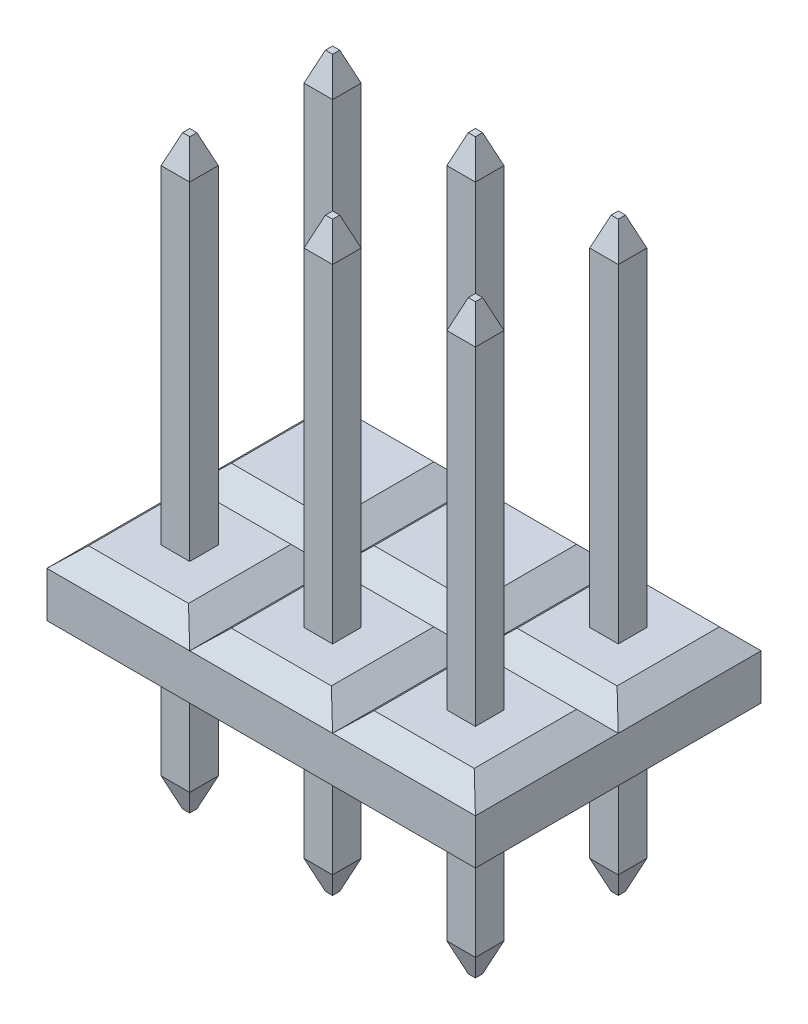
from build123d import *
from OCP.BRepFilletAPI import BRepFilletAPI_MakeChamfer

# Parameters (mm, degrees)
SKETCH1_W                   = 2.54
SKETCH1_H                   = 2.54
BOSS_EXTRUDE1_DEPTH         = 1.524
SKETCH2_W                   = 0.508
SKETCH2_H                   = 0.508
BOSS_EXTRUDE2_DEPTH         = 6.35
SKETCH3_W                   = 0.508
SKETCH3_H                   = 0.508
BOSS_EXTRUDE3_DEPTH         = 2.54
CHAMFER1_SIZE               = 0.508
CHAMFER1_SIZE2              = 0.1905
CHAMFER2_SIZE               = 0.508
CHAMFER2_SIZE2              = 0.1905
CUT_EXTRUDE1_DEPTH          = 2.54
CUT_EXTRUDE2_DEPTH          = 2.54
LPATTERN5_COUNT             = 2
LPATTERN5_PITCH             = 2.54
LPATTERN5_COUNT_DIR2        = 3
LPATTERN5_PITCH_DIR2        = 2.54
CHAMFER1_OF_LPATTERN5_SIZE  = 0.508
CHAMFER1_OF_LPATTERN5_SIZE2 = 0.1905
CHAMFER2_OF_LPATTERN5_SIZE  = 0.508
CHAMFER2_OF_LPATTERN5_SIZE2 = 0.1905


with BuildPart() as part:
    # Sketch1 → Boss-Extrude1 (new body)
    with BuildSketch(Plane(origin=(0, 0, 0), x_dir=(1, 0, 0), z_dir=(0, 1, 0))):
        with Locations((1.27, 1.27)):
            Rectangle(SKETCH1_W, SKETCH1_H)
    boss_extrude1 = extrude(amount=BOSS_EXTRUDE1_DEPTH)

    # Sketch2 → Boss-Extrude2 (add)
    with BuildSketch(Plane(origin=(0, 1.524, 0), x_dir=(1, 0, 0), z_dir=(0, 1, 0))):
        with Locations((1.27, 1.27)):
            Rectangle(SKETCH2_W, SKETCH2_H)
    boss_extrude2 = extrude(amount=BOSS_EXTRUDE2_DEPTH)

    # Sketch3 → Boss-Extrude3 (add)
    with BuildSketch(Plane.XZ):
        with Locations((1.27, -1.27)):
            Rectangle(SKETCH3_W, SKETCH3_H)
    boss_extrude3 = extrude(amount=BOSS_EXTRUDE3_DEPTH)

    # Chamfer1: one chamfer whose edges measure the first distance from different faces: ONE call of the kernel's chamfer builder (chamfer() names one face for all edges)
    chamfer1_edges_1 = [part.edges().sort_by_distance(p)[0] for p in [
        (1.016, 7.874, -1.27),
    ]]
    chamfer1_side_1 = [part.faces().sort_by_distance(p)[0] for p in [
        (1.016, 4.699, -1.27),
    ]]
    chamfer1_edges_2 = [part.edges().sort_by_distance(p)[0] for p in [
        (1.27, 7.874, -1.016),
    ]]
    chamfer1_side_2 = [part.faces().sort_by_distance(p)[0] for p in [
        (1.27, 4.699, -1.016),
    ]]
    chamfer1_edges_3 = [part.edges().sort_by_distance(p)[0] for p in [
        (1.524, 7.874, -1.27),
    ]]
    chamfer1_side_3 = [part.faces().sort_by_distance(p)[0] for p in [
        (1.524, 4.699, -1.27),
    ]]
    chamfer1_edges_4 = [part.edges().sort_by_distance(p)[0] for p in [
        (1.27, 7.874, -1.524),
    ]]
    chamfer1_side_4 = [part.faces().sort_by_distance(p)[0] for p in [
        (1.27, 4.699, -1.524),
    ]]
    chamfer1 = BRepFilletAPI_MakeChamfer(part.part.solid().wrapped)
    for e in chamfer1_edges_1:
        chamfer1.Add(CHAMFER1_SIZE, CHAMFER1_SIZE2, e.wrapped, chamfer1_side_1[0].wrapped)  # the first distance lies on this face
    for e in chamfer1_edges_2:
        chamfer1.Add(CHAMFER1_SIZE, CHAMFER1_SIZE2, e.wrapped, chamfer1_side_2[0].wrapped)  # the first distance lies on this face
    for e in chamfer1_edges_3:
        chamfer1.Add(CHAMFER1_SIZE, CHAMFER1_SIZE2, e.wrapped, chamfer1_side_3[0].wrapped)  # the first distance lies on this face
    for e in chamfer1_edges_4:
        chamfer1.Add(CHAMFER1_SIZE, CHAMFER1_SIZE2, e.wrapped, chamfer1_side_4[0].wrapped)  # the first distance lies on this face
    add(Compound.cast(chamfer1.Shape()), mode=Mode.REPLACE)

    # Chamfer2: one chamfer whose edges measure the first distance from different faces: ONE call of the kernel's chamfer builder (chamfer() names one face for all edges)
    chamfer2_edges_1 = [part.edges().sort_by_distance(p)[0] for p in [
        (1.27, -2.54, -1.524),
    ]]
    chamfer2_side_1 = [part.faces().sort_by_distance(p)[0] for p in [
        (1.27, -1.27, -1.524),
    ]]
    chamfer2_edges_2 = [part.edges().sort_by_distance(p)[0] for p in [
        (1.524, -2.54, -1.27),
    ]]
    chamfer2_side_2 = [part.faces().sort_by_distance(p)[0] for p in [
        (1.524, -1.27, -1.27),
    ]]
    chamfer2_edges_3 = [part.edges().sort_by_distance(p)[0] for p in [
        (1.27, -2.54, -1.016),
    ]]
    chamfer2_side_3 = [part.faces().sort_by_distance(p)[0] for p in [
        (1.27, -1.27, -1.016),
    ]]
    chamfer2_edges_4 = [part.edges().sort_by_distance(p)[0] for p in [
        (1.016, -2.54, -1.27),
    ]]
    chamfer2_side_4 = [part.faces().sort_by_distance(p)[0] for p in [
        (1.016, -1.27, -1.27),
    ]]
    chamfer2 = BRepFilletAPI_MakeChamfer(part.part.solid().wrapped)
    for e in chamfer2_edges_1:
        chamfer2.Add(CHAMFER2_SIZE, CHAMFER2_SIZE2, e.wrapped, chamfer2_side_1[0].wrapped)  # the first distance lies on this face
    for e in chamfer2_edges_2:
        chamfer2.Add(CHAMFER2_SIZE, CHAMFER2_SIZE2, e.wrapped, chamfer2_side_2[0].wrapped)  # the first distance lies on this face
    for e in chamfer2_edges_3:
        chamfer2.Add(CHAMFER2_SIZE, CHAMFER2_SIZE2, e.wrapped, chamfer2_side_3[0].wrapped)  # the first distance lies on this face
    for e in chamfer2_edges_4:
        chamfer2.Add(CHAMFER2_SIZE, CHAMFER2_SIZE2, e.wrapped, chamfer2_side_4[0].wrapped)  # the first distance lies on this face
    add(Compound.cast(chamfer2.Shape()), mode=Mode.REPLACE)

    # Sketch4 → Cut-Extrude1 (cut)
    with BuildSketch(Plane(origin=(0, 0, -2.54), x_dir=(-1, 0, 0), z_dir=(0, 0, -1))):
        Polygon((-2.54, 1.16453539), (-2.159, 1.524), (-2.54, 1.524), align=None)
        Polygon((0, 1.524), (0, 1.16453539), (-0.381, 1.524), align=None)
        Polygon((0, 0.35946461), (-0.381, 0), (0, 0), align=None)
        Polygon((-2.54, 0), (-2.54, 0.35946461), (-2.159, 0), align=None)
    cut_extrude1 = extrude(amount=-CUT_EXTRUDE1_DEPTH, mode=Mode.SUBTRACT)

    # Sketch5 → Cut-Extrude2 (cut)
    with BuildSketch(Plane.ZY):
        Polygon((-2.54, 1.16453539), (-2.159, 1.54553539), (-2.54, 1.54553539), align=None)
        Polygon((0, 1.54553539), (0, 1.16453539), (-0.381, 1.54553539), align=None)
        Polygon((-2.54, -0.02153539), (-2.54, 0.35946461), (-2.159, -0.02153539), align=None)
        Polygon((0, 0.35946461), (-0.381, -0.02153539), (0, -0.02153539), align=None)
    cut_extrude2 = extrude(amount=-CUT_EXTRUDE2_DEPTH, mode=Mode.SUBTRACT)

    # LPattern5: Boss-Extrude1, Boss-Extrude2, Boss-Extrude3, Cut-Extrude1, Cut-Extrude2 2 × 3
    with Locations(*[(j * LPATTERN5_PITCH_DIR2, 0, i * LPATTERN5_PITCH) for i in range(LPATTERN5_COUNT) for j in range(LPATTERN5_COUNT_DIR2) if (i, j) != (0, 0)]):
        add(boss_extrude1)
        add(boss_extrude2)
        add(boss_extrude3)
        add(cut_extrude1, mode=Mode.SUBTRACT)
        add(cut_extrude2, mode=Mode.SUBTRACT)

    # Chamfer1 of LPattern5: one chamfer whose edges measure the first distance from different faces: ONE call of the kernel's chamfer builder (chamfer() names one face for all edges)
    chamfer1_of_lpattern5_edges_1 = [part.edges().sort_by_distance(p)[0] for p in [
        (3.556, 7.874, -1.27),
    ]]
    chamfer1_of_lpattern5_side_1 = [part.faces().sort_by_distance(p)[0] for p in [
        (3.556, 4.699, -1.27),
    ]]
    chamfer1_of_lpattern5_edges_2 = [part.edges().sort_by_distance(p)[0] for p in [
        (3.81, 7.874, -1.016),
    ]]
    chamfer1_of_lpattern5_side_2 = [part.faces().sort_by_distance(p)[0] for p in [
        (3.81, 4.699, -1.016),
    ]]
    chamfer1_of_lpattern5_edges_3 = [part.edges().sort_by_distance(p)[0] for p in [
        (4.064, 7.874, -1.27),
    ]]
    chamfer1_of_lpattern5_side_3 = [part.faces().sort_by_distance(p)[0] for p in [
        (4.064, 4.699, -1.27),
    ]]
    chamfer1_of_lpattern5_edges_4 = [part.edges().sort_by_distance(p)[0] for p in [
        (3.81, 7.874, -1.524),
    ]]
    chamfer1_of_lpattern5_side_4 = [part.faces().sort_by_distance(p)[0] for p in [
        (3.81, 4.699, -1.524),
    ]]
    chamfer1_of_lpattern5_edges_5 = [part.edges().sort_by_distance(p)[0] for p in [
        (6.096, 7.874, -1.27),
    ]]
    chamfer1_of_lpattern5_side_5 = [part.faces().sort_by_distance(p)[0] for p in [
        (6.096, 4.699, -1.27),
    ]]
    chamfer1_of_lpattern5_edges_6 = [part.edges().sort_by_distance(p)[0] for p in [
        (6.35, 7.874, -1.016),
    ]]
    chamfer1_of_lpattern5_side_6 = [part.faces().sort_by_distance(p)[0] for p in [
        (6.35, 4.699, -1.016),
    ]]
    chamfer1_of_lpattern5_edges_7 = [part.edges().sort_by_distance(p)[0] for p in [
        (6.604, 7.874, -1.27),
    ]]
    chamfer1_of_lpattern5_side_7 = [part.faces().sort_by_distance(p)[0] for p in [
        (6.604, 4.699, -1.27),
    ]]
    chamfer1_of_lpattern5_edges_8 = [part.edges().sort_by_distance(p)[0] for p in [
        (6.35, 7.874, -1.524),
    ]]
    chamfer1_of_lpattern5_side_8 = [part.faces().sort_by_distance(p)[0] for p in [
        (6.35, 4.699, -1.524),
    ]]
    chamfer1_of_lpattern5_edges_9 = [part.edges().sort_by_distance(p)[0] for p in [
        (1.016, 7.874, 1.27),
    ]]
    chamfer1_of_lpattern5_side_9 = [part.faces().sort_by_distance(p)[0] for p in [
        (1.016, 4.699, 1.27),
    ]]
    chamfer1_of_lpattern5_edges_10 = [part.edges().sort_by_distance(p)[0] for p in [
        (1.27, 7.874, 1.524),
    ]]
    chamfer1_of_lpattern5_side_10 = [part.faces().sort_by_distance(p)[0] for p in [
        (1.27, 4.699, 1.524),
    ]]
    chamfer1_of_lpattern5_edges_11 = [part.edges().sort_by_distance(p)[0] for p in [
        (1.524, 7.874, 1.27),
    ]]
    chamfer1_of_lpattern5_side_11 = [part.faces().sort_by_distance(p)[0] for p in [
        (1.524, 4.699, 1.27),
    ]]
    chamfer1_of_lpattern5_edges_12 = [part.edges().sort_by_distance(p)[0] for p in [
        (1.27, 7.874, 1.016),
    ]]
    chamfer1_of_lpattern5_side_12 = [part.faces().sort_by_distance(p)[0] for p in [
        (1.27, 4.699, 1.016),
    ]]
    chamfer1_of_lpattern5_edges_13 = [part.edges().sort_by_distance(p)[0] for p in [
        (3.556, 7.874, 1.27),
    ]]
    chamfer1_of_lpattern5_side_13 = [part.faces().sort_by_distance(p)[0] for p in [
        (3.556, 4.699, 1.27),
    ]]
    chamfer1_of_lpattern5_edges_14 = [part.edges().sort_by_distance(p)[0] for p in [
        (3.81, 7.874, 1.524),
    ]]
    chamfer1_of_lpattern5_side_14 = [part.faces().sort_by_distance(p)[0] for p in [
        (3.81, 4.699, 1.524),
    ]]
    chamfer1_of_lpattern5_edges_15 = [part.edges().sort_by_distance(p)[0] for p in [
        (4.064, 7.874, 1.27),
    ]]
    chamfer1_of_lpattern5_side_15 = [part.faces().sort_by_distance(p)[0] for p in [
        (4.064, 4.699, 1.27),
    ]]
    chamfer1_of_lpattern5_edges_16 = [part.edges().sort_by_distance(p)[0] for p in [
        (3.81, 7.874, 1.016),
    ]]
    chamfer1_of_lpattern5_side_16 = [part.faces().sort_by_distance(p)[0] for p in [
        (3.81, 4.699, 1.016),
    ]]
    chamfer1_of_lpattern5_edges_17 = [part.edges().sort_by_distance(p)[0] for p in [
        (6.096, 7.874, 1.27),
    ]]
    chamfer1_of_lpattern5_side_17 = [part.faces().sort_by_distance(p)[0] for p in [
        (6.096, 4.699, 1.27),
    ]]
    chamfer1_of_lpattern5_edges_18 = [part.edges().sort_by_distance(p)[0] for p in [
        (6.35, 7.874, 1.524),
    ]]
    chamfer1_of_lpattern5_side_18 = [part.faces().sort_by_distance(p)[0] for p in [
        (6.35, 4.699, 1.524),
    ]]
    chamfer1_of_lpattern5_edges_19 = [part.edges().sort_by_distance(p)[0] for p in [
        (6.604, 7.874, 1.27),
    ]]
    chamfer1_of_lpattern5_side_19 = [part.faces().sort_by_distance(p)[0] for p in [
        (6.604, 4.699, 1.27),
    ]]
    chamfer1_of_lpattern5_edges_20 = [part.edges().sort_by_distance(p)[0] for p in [
        (6.35, 7.874, 1.016),
    ]]
    chamfer1_of_lpattern5_side_20 = [part.faces().sort_by_distance(p)[0] for p in [
        (6.35, 4.699, 1.016),
    ]]
    chamfer1_of_lpattern5 = BRepFilletAPI_MakeChamfer(part.part.solid().wrapped)
    for e in chamfer1_of_lpattern5_edges_1:
        chamfer1_of_lpattern5.Add(CHAMFER1_OF_LPATTERN5_SIZE, CHAMFER1_OF_LPATTERN5_SIZE2, e.wrapped, chamfer1_of_lpattern5_side_1[0].wrapped)  # the first distance lies on this face
    for e in chamfer1_of_lpattern5_edges_2:
        chamfer1_of_lpattern5.Add(CHAMFER1_OF_LPATTERN5_SIZE, CHAMFER1_OF_LPATTERN5_SIZE2, e.wrapped, chamfer1_of_lpattern5_side_2[0].wrapped)  # the first distance lies on this face
    for e in chamfer1_of_lpattern5_edges_3:
        chamfer1_of_lpattern5.Add(CHAMFER1_OF_LPATTERN5_SIZE, CHAMFER1_OF_LPATTERN5_SIZE2, e.wrapped, chamfer1_of_lpattern5_side_3[0].wrapped)  # the first distance lies on this face
    for e in chamfer1_of_lpattern5_edges_4:
        chamfer1_of_lpattern5.Add(CHAMFER1_OF_LPATTERN5_SIZE, CHAMFER1_OF_LPATTERN5_SIZE2, e.wrapped, chamfer1_of_lpattern5_side_4[0].wrapped)  # the first distance lies on this face
    for e in chamfer1_of_lpattern5_edges_5:
        chamfer1_of_lpattern5.Add(CHAMFER1_OF_LPATTERN5_SIZE, CHAMFER1_OF_LPATTERN5_SIZE2, e.wrapped, chamfer1_of_lpattern5_side_5[0].wrapped)  # the first distance lies on this face
    for e in chamfer1_of_lpattern5_edges_6:
        chamfer1_of_lpattern5.Add(CHAMFER1_OF_LPATTERN5_SIZE, CHAMFER1_OF_LPATTERN5_SIZE2, e.wrapped, chamfer1_of_lpattern5_side_6[0].wrapped)  # the first distance lies on this face
    for e in chamfer1_of_lpattern5_edges_7:
        chamfer1_of_lpattern5.Add(CHAMFER1_OF_LPATTERN5_SIZE, CHAMFER1_OF_LPATTERN5_SIZE2, e.wrapped, chamfer1_of_lpattern5_side_7[0].wrapped)  # the first distance lies on this face
    for e in chamfer1_of_lpattern5_edges_8:
        chamfer1_of_lpattern5.Add(CHAMFER1_OF_LPATTERN5_SIZE, CHAMFER1_OF_LPATTERN5_SIZE2, e.wrapped, chamfer1_of_lpattern5_side_8[0].wrapped)  # the first distance lies on this face
    for e in chamfer1_of_lpattern5_edges_9:
        chamfer1_of_lpattern5.Add(CHAMFER1_OF_LPATTERN5_SIZE, CHAMFER1_OF_LPATTERN5_SIZE2, e.wrapped, chamfer1_of_lpattern5_side_9[0].wrapped)  # the first distance lies on this face
    for e in chamfer1_of_lpattern5_edges_10:
        chamfer1_of_lpattern5.Add(CHAMFER1_OF_LPATTERN5_SIZE, CHAMFER1_OF_LPATTERN5_SIZE2, e.wrapped, chamfer1_of_lpattern5_side_10[0].wrapped)  # the first distance lies on this face
    for e in chamfer1_of_lpattern5_edges_11:
        chamfer1_of_lpattern5.Add(CHAMFER1_OF_LPATTERN5_SIZE, CHAMFER1_OF_LPATTERN5_SIZE2, e.wrapped, chamfer1_of_lpattern5_side_11[0].wrapped)  # the first distance lies on this face
    for e in chamfer1_of_lpattern5_edges_12:
        chamfer1_of_lpattern5.Add(CHAMFER1_OF_LPATTERN5_SIZE, CHAMFER1_OF_LPATTERN5_SIZE2, e.wrapped, chamfer1_of_lpattern5_side_12[0].wrapped)  # the first distance lies on this face
    for e in chamfer1_of_lpattern5_edges_13:
        chamfer1_of_lpattern5.Add(CHAMFER1_OF_LPATTERN5_SIZE, CHAMFER1_OF_LPATTERN5_SIZE2, e.wrapped, chamfer1_of_lpattern5_side_13[0].wrapped)  # the first distance lies on this face
    for e in chamfer1_of_lpattern5_edges_14:
        chamfer1_of_lpattern5.Add(CHAMFER1_OF_LPATTERN5_SIZE, CHAMFER1_OF_LPATTERN5_SIZE2, e.wrapped, chamfer1_of_lpattern5_side_14[0].wrapped)  # the first distance lies on this face
    for e in chamfer1_of_lpattern5_edges_15:
        chamfer1_of_lpattern5.Add(CHAMFER1_OF_LPATTERN5_SIZE, CHAMFER1_OF_LPATTERN5_SIZE2, e.wrapped, chamfer1_of_lpattern5_side_15[0].wrapped)  # the first distance lies on this face
    for e in chamfer1_of_lpattern5_edges_16:
        chamfer1_of_lpattern5.Add(CHAMFER1_OF_LPATTERN5_SIZE, CHAMFER1_OF_LPATTERN5_SIZE2, e.wrapped, chamfer1_of_lpattern5_side_16[0].wrapped)  # the first distance lies on this face
    for e in chamfer1_of_lpattern5_edges_17:
        chamfer1_of_lpattern5.Add(CHAMFER1_OF_LPATTERN5_SIZE, CHAMFER1_OF_LPATTERN5_SIZE2, e.wrapped, chamfer1_of_lpattern5_side_17[0].wrapped)  # the first distance lies on this face
    for e in chamfer1_of_lpattern5_edges_18:
        chamfer1_of_lpattern5.Add(CHAMFER1_OF_LPATTERN5_SIZE, CHAMFER1_OF_LPATTERN5_SIZE2, e.wrapped, chamfer1_of_lpattern5_side_18[0].wrapped)  # the first distance lies on this face
    for e in chamfer1_of_lpattern5_edges_19:
        chamfer1_of_lpattern5.Add(CHAMFER1_OF_LPATTERN5_SIZE, CHAMFER1_OF_LPATTERN5_SIZE2, e.wrapped, chamfer1_of_lpattern5_side_19[0].wrapped)  # the first distance lies on this face
    for e in chamfer1_of_lpattern5_edges_20:
        chamfer1_of_lpattern5.Add(CHAMFER1_OF_LPATTERN5_SIZE, CHAMFER1_OF_LPATTERN5_SIZE2, e.wrapped, chamfer1_of_lpattern5_side_20[0].wrapped)  # the first distance lies on this face
    add(Compound.cast(chamfer1_of_lpattern5.Shape()), mode=Mode.REPLACE)

    # Chamfer2 of LPattern5: one chamfer whose edges measure the first distance from different faces: ONE call of the kernel's chamfer builder (chamfer() names one face for all edges)
    chamfer2_of_lpattern5_edges_1 = [part.edges().sort_by_distance(p)[0] for p in [
        (3.81, -2.54, -1.524),
    ]]
    chamfer2_of_lpattern5_side_1 = [part.faces().sort_by_distance(p)[0] for p in [
        (3.81, -1.27, -1.524),
    ]]
    chamfer2_of_lpattern5_edges_2 = [part.edges().sort_by_distance(p)[0] for p in [
        (4.064, -2.54, -1.27),
    ]]
    chamfer2_of_lpattern5_side_2 = [part.faces().sort_by_distance(p)[0] for p in [
        (4.064, -1.27, -1.27),
    ]]
    chamfer2_of_lpattern5_edges_3 = [part.edges().sort_by_distance(p)[0] for p in [
        (3.81, -2.54, -1.016),
    ]]
    chamfer2_of_lpattern5_side_3 = [part.faces().sort_by_distance(p)[0] for p in [
        (3.81, -1.27, -1.016),
    ]]
    chamfer2_of_lpattern5_edges_4 = [part.edges().sort_by_distance(p)[0] for p in [
        (3.556, -2.54, -1.27),
    ]]
    chamfer2_of_lpattern5_side_4 = [part.faces().sort_by_distance(p)[0] for p in [
        (3.556, -1.27, -1.27),
    ]]
    chamfer2_of_lpattern5_edges_5 = [part.edges().sort_by_distance(p)[0] for p in [
        (6.35, -2.54, -1.524),
    ]]
    chamfer2_of_lpattern5_side_5 = [part.faces().sort_by_distance(p)[0] for p in [
        (6.35, -1.27, -1.524),
    ]]
    chamfer2_of_lpattern5_edges_6 = [part.edges().sort_by_distance(p)[0] for p in [
        (6.604, -2.54, -1.27),
    ]]
    chamfer2_of_lpattern5_side_6 = [part.faces().sort_by_distance(p)[0] for p in [
        (6.604, -1.27, -1.27),
    ]]
    chamfer2_of_lpattern5_edges_7 = [part.edges().sort_by_distance(p)[0] for p in [
        (6.35, -2.54, -1.016),
    ]]
    chamfer2_of_lpattern5_side_7 = [part.faces().sort_by_distance(p)[0] for p in [
        (6.35, -1.27, -1.016),
    ]]
    chamfer2_of_lpattern5_edges_8 = [part.edges().sort_by_distance(p)[0] for p in [
        (6.096, -2.54, -1.27),
    ]]
    chamfer2_of_lpattern5_side_8 = [part.faces().sort_by_distance(p)[0] for p in [
        (6.096, -1.27, -1.27),
    ]]
    chamfer2_of_lpattern5_edges_9 = [part.edges().sort_by_distance(p)[0] for p in [
        (1.27, -2.54, 1.016),
    ]]
    chamfer2_of_lpattern5_side_9 = [part.faces().sort_by_distance(p)[0] for p in [
        (1.27, -1.27, 1.016),
    ]]
    chamfer2_of_lpattern5_edges_10 = [part.edges().sort_by_distance(p)[0] for p in [
        (1.524, -2.54, 1.27),
    ]]
    chamfer2_of_lpattern5_side_10 = [part.faces().sort_by_distance(p)[0] for p in [
        (1.524, -1.27, 1.27),
    ]]
    chamfer2_of_lpattern5_edges_11 = [part.edges().sort_by_distance(p)[0] for p in [
        (1.27, -2.54, 1.524),
    ]]
    chamfer2_of_lpattern5_side_11 = [part.faces().sort_by_distance(p)[0] for p in [
        (1.27, -1.27, 1.524),
    ]]
    chamfer2_of_lpattern5_edges_12 = [part.edges().sort_by_distance(p)[0] for p in [
        (1.016, -2.54, 1.27),
    ]]
    chamfer2_of_lpattern5_side_12 = [part.faces().sort_by_distance(p)[0] for p in [
        (1.016, -1.27, 1.27),
    ]]
    chamfer2_of_lpattern5_edges_13 = [part.edges().sort_by_distance(p)[0] for p in [
        (3.81, -2.54, 1.016),
    ]]
    chamfer2_of_lpattern5_side_13 = [part.faces().sort_by_distance(p)[0] for p in [
        (3.81, -1.27, 1.016),
    ]]
    chamfer2_of_lpattern5_edges_14 = [part.edges().sort_by_distance(p)[0] for p in [
        (4.064, -2.54, 1.27),
    ]]
    chamfer2_of_lpattern5_side_14 = [part.faces().sort_by_distance(p)[0] for p in [
        (4.064, -1.27, 1.27),
    ]]
    chamfer2_of_lpattern5_edges_15 = [part.edges().sort_by_distance(p)[0] for p in [
        (3.81, -2.54, 1.524),
    ]]
    chamfer2_of_lpattern5_side_15 = [part.faces().sort_by_distance(p)[0] for p in [
        (3.81, -1.27, 1.524),
    ]]
    chamfer2_of_lpattern5_edges_16 = [part.edges().sort_by_distance(p)[0] for p in [
        (3.556, -2.54, 1.27),
    ]]
    chamfer2_of_lpattern5_side_16 = [part.faces().sort_by_distance(p)[0] for p in [
        (3.556, -1.27, 1.27),
    ]]
    chamfer2_of_lpattern5_edges_17 = [part.edges().sort_by_distance(p)[0] for p in [
        (6.35, -2.54, 1.016),
    ]]
    chamfer2_of_lpattern5_side_17 = [part.faces().sort_by_distance(p)[0] for p in [
        (6.35, -1.27, 1.016),
    ]]
    chamfer2_of_lpattern5_edges_18 = [part.edges().sort_by_distance(p)[0] for p in [
        (6.604, -2.54, 1.27),
    ]]
    chamfer2_of_lpattern5_side_18 = [part.faces().sort_by_distance(p)[0] for p in [
        (6.604, -1.27, 1.27),
    ]]
    chamfer2_of_lpattern5_edges_19 = [part.edges().sort_by_distance(p)[0] for p in [
        (6.35, -2.54, 1.524),
    ]]
    chamfer2_of_lpattern5_side_19 = [part.faces().sort_by_distance(p)[0] for p in [
        (6.35, -1.27, 1.524),
    ]]
    chamfer2_of_lpattern5_edges_20 = [part.edges().sort_by_distance(p)[0] for p in [
        (6.096, -2.54, 1.27),
    ]]
    chamfer2_of_lpattern5_side_20 = [part.faces().sort_by_distance(p)[0] for p in [
        (6.096, -1.27, 1.27),
    ]]
    chamfer2_of_lpattern5 = BRepFilletAPI_MakeChamfer(part.part.solid().wrapped)
    for e in chamfer2_of_lpattern5_edges_1:
        chamfer2_of_lpattern5.Add(CHAMFER2_OF_LPATTERN5_SIZE, CHAMFER2_OF_LPATTERN5_SIZE2, e.wrapped, chamfer2_of_lpattern5_side_1[0].wrapped)  # the first distance lies on this face
    for e in chamfer2_of_lpattern5_edges_2:
        chamfer2_of_lpattern5.Add(CHAMFER2_OF_LPATTERN5_SIZE, CHAMFER2_OF_LPATTERN5_SIZE2, e.wrapped, chamfer2_of_lpattern5_side_2[0].wrapped)  # the first distance lies on this face
    for e in chamfer2_of_lpattern5_edges_3:
        chamfer2_of_lpattern5.Add(CHAMFER2_OF_LPATTERN5_SIZE, CHAMFER2_OF_LPATTERN5_SIZE2, e.wrapped, chamfer2_of_lpattern5_side_3[0].wrapped)  # the first distance lies on this face
    for e in chamfer2_of_lpattern5_edges_4:
        chamfer2_of_lpattern5.Add(CHAMFER2_OF_LPATTERN5_SIZE, CHAMFER2_OF_LPATTERN5_SIZE2, e.wrapped, chamfer2_of_lpattern5_side_4[0].wrapped)  # the first distance lies on this face
    for e in chamfer2_of_lpattern5_edges_5:
        chamfer2_of_lpattern5.Add(CHAMFER2_OF_LPATTERN5_SIZE, CHAMFER2_OF_LPATTERN5_SIZE2, e.wrapped, chamfer2_of_lpattern5_side_5[0].wrapped)  # the first distance lies on this face
    for e in chamfer2_of_lpattern5_edges_6:
        chamfer2_of_lpattern5.Add(CHAMFER2_OF_LPATTERN5_SIZE, CHAMFER2_OF_LPATTERN5_SIZE2, e.wrapped, chamfer2_of_lpattern5_side_6[0].wrapped)  # the first distance lies on this face
    for e in chamfer2_of_lpattern5_edges_7:
        chamfer2_of_lpattern5.Add(CHAMFER2_OF_LPATTERN5_SIZE, CHAMFER2_OF_LPATTERN5_SIZE2, e.wrapped, chamfer2_of_lpattern5_side_7[0].wrapped)  # the first distance lies on this face
    for e in chamfer2_of_lpattern5_edges_8:
        chamfer2_of_lpattern5.Add(CHAMFER2_OF_LPATTERN5_SIZE, CHAMFER2_OF_LPATTERN5_SIZE2, e.wrapped, chamfer2_of_lpattern5_side_8[0].wrapped)  # the first distance lies on this face
    for e in chamfer2_of_lpattern5_edges_9:
        chamfer2_of_lpattern5.Add(CHAMFER2_OF_LPATTERN5_SIZE, CHAMFER2_OF_LPATTERN5_SIZE2, e.wrapped, chamfer2_of_lpattern5_side_9[0].wrapped)  # the first distance lies on this face
    for e in chamfer2_of_lpattern5_edges_10:
        chamfer2_of_lpattern5.Add(CHAMFER2_OF_LPATTERN5_SIZE, CHAMFER2_OF_LPATTERN5_SIZE2, e.wrapped, chamfer2_of_lpattern5_side_10[0].wrapped)  # the first distance lies on this face
    for e in chamfer2_of_lpattern5_edges_11:
        chamfer2_of_lpattern5.Add(CHAMFER2_OF_LPATTERN5_SIZE, CHAMFER2_OF_LPATTERN5_SIZE2, e.wrapped, chamfer2_of_lpattern5_side_11[0].wrapped)  # the first distance lies on this face
    for e in chamfer2_of_lpattern5_edges_12:
        chamfer2_of_lpattern5.Add(CHAMFER2_OF_LPATTERN5_SIZE, CHAMFER2_OF_LPATTERN5_SIZE2, e.wrapped, chamfer2_of_lpattern5_side_12[0].wrapped)  # the first distance lies on this face
    for e in chamfer2_of_lpattern5_edges_13:
        chamfer2_of_lpattern5.Add(CHAMFER2_OF_LPATTERN5_SIZE, CHAMFER2_OF_LPATTERN5_SIZE2, e.wrapped, chamfer2_of_lpattern5_side_13[0].wrapped)  # the first distance lies on this face
    for e in chamfer2_of_lpattern5_edges_14:
        chamfer2_of_lpattern5.Add(CHAMFER2_OF_LPATTERN5_SIZE, CHAMFER2_OF_LPATTERN5_SIZE2, e.wrapped, chamfer2_of_lpattern5_side_14[0].wrapped)  # the first distance lies on this face
    for e in chamfer2_of_lpattern5_edges_15:
        chamfer2_of_lpattern5.Add(CHAMFER2_OF_LPATTERN5_SIZE, CHAMFER2_OF_LPATTERN5_SIZE2, e.wrapped, chamfer2_of_lpattern5_side_15[0].wrapped)  # the first distance lies on this face
    for e in chamfer2_of_lpattern5_edges_16:
        chamfer2_of_lpattern5.Add(CHAMFER2_OF_LPATTERN5_SIZE, CHAMFER2_OF_LPATTERN5_SIZE2, e.wrapped, chamfer2_of_lpattern5_side_16[0].wrapped)  # the first distance lies on this face
    for e in chamfer2_of_lpattern5_edges_17:
        chamfer2_of_lpattern5.Add(CHAMFER2_OF_LPATTERN5_SIZE, CHAMFER2_OF_LPATTERN5_SIZE2, e.wrapped, chamfer2_of_lpattern5_side_17[0].wrapped)  # the first distance lies on this face
    for e in chamfer2_of_lpattern5_edges_18:
        chamfer2_of_lpattern5.Add(CHAMFER2_OF_LPATTERN5_SIZE, CHAMFER2_OF_LPATTERN5_SIZE2, e.wrapped, chamfer2_of_lpattern5_side_18[0].wrapped)  # the first distance lies on this face
    for e in chamfer2_of_lpattern5_edges_19:
        chamfer2_of_lpattern5.Add(CHAMFER2_OF_LPATTERN5_SIZE, CHAMFER2_OF_LPATTERN5_SIZE2, e.wrapped, chamfer2_of_lpattern5_side_19[0].wrapped)  # the first distance lies on this face
    for e in chamfer2_of_lpattern5_edges_20:
        chamfer2_of_lpattern5.Add(CHAMFER2_OF_LPATTERN5_SIZE, CHAMFER2_OF_LPATTERN5_SIZE2, e.wrapped, chamfer2_of_lpattern5_side_20[0].wrapped)  # the first distance lies on this face
    add(Compound.cast(chamfer2_of_lpattern5.Shape()), mode=Mode.REPLACE)


solid = part.part
